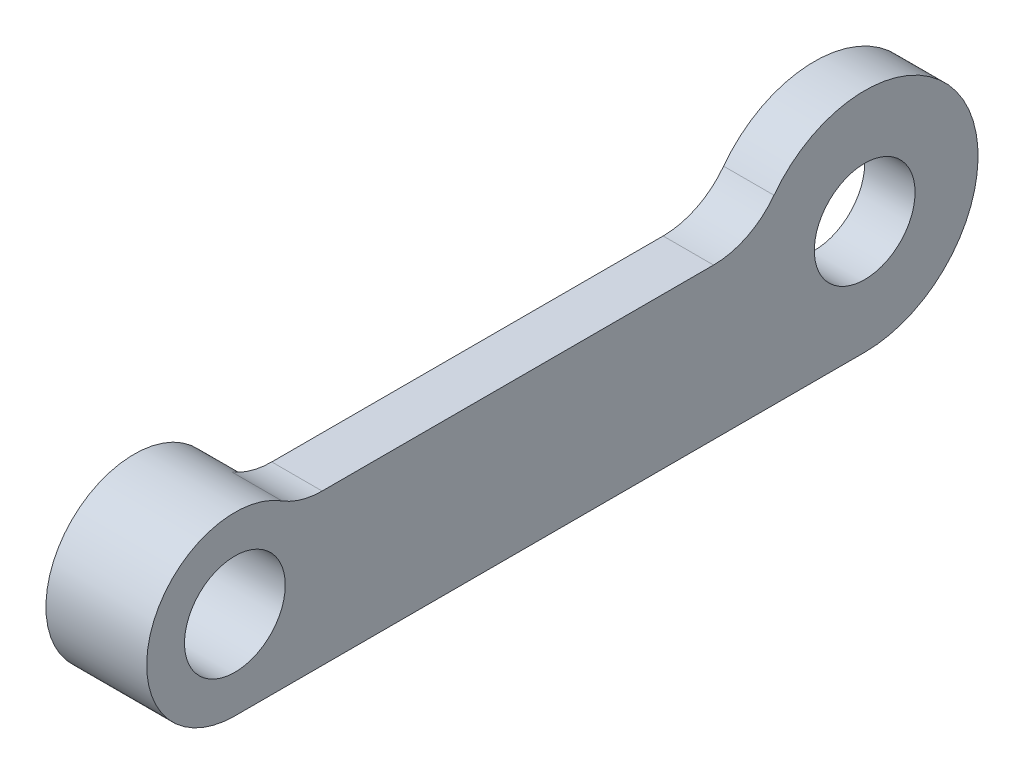
from build123d import *

# Parameters (mm, degrees)
SKETCH_1_R               = 3.5
SKETCH_1_R_2             = 4.5
SKETCH_1_W               = 25
SKETCH_1_H               = 6
EXTRUDE_1_DEPTH          = 2
EXTRUDE_START            = -2
SKETCH_1_5_R             = 3.5
EXTRUDE_3_DEPTH          = 2
CUT_EXTRUDE_2_DEPTH      = 31.170349683
CUT_EXTRUDE_2_DEPTH_BACK = 31.170349683
SKETCH_1_4_R             = 2
FILLET_1_R               = 3


with BuildPart() as part:
    # 草图1 → 凸台-拉伸1 (new body)
    with BuildSketch(Plane(origin=(0, 0, 0), x_dir=(0, 0, -1), z_dir=(1, 0, 0))):
        with Locations((0, -2.5)):
            Circle(SKETCH_1_R)
        with Locations((25, -1.5)):
            Circle(SKETCH_1_R_2)
        with Locations((12.5, -3)):
            Rectangle(SKETCH_1_W, SKETCH_1_H)
    extrude(amount=EXTRUDE_1_DEPTH)

    # 草图1<5> → 凸台-拉伸3 (add)
    with BuildSketch(Plane(origin=(0, 0, 0), x_dir=(0, 0, -1), z_dir=(1, 0, 0)).offset(EXTRUDE_START)):
        with Locations((0, -2.5)):
            Circle(SKETCH_1_5_R)
    extrude(amount=EXTRUDE_3_DEPTH)

    # 草图1<4> → 切除-拉伸2 (cut, two sides: drawn at the far end of the back side and taken through both)
    with BuildSketch(Plane(origin=(0, 0, 0), x_dir=(0, 0, -1), z_dir=(1, 0, 0)).offset(-CUT_EXTRUDE_2_DEPTH_BACK)):
        with Locations((0, -2.5)):
            Circle(SKETCH_1_4_R)
        with Locations((25, -1.5)):
            Circle(SKETCH_1_4_R)
    extrude(amount=CUT_EXTRUDE_2_DEPTH + CUT_EXTRUDE_2_DEPTH_BACK, mode=Mode.SUBTRACT)

    # 圆角1
    fillet_1_edges = [part.edges().sort_by_distance(p)[0] for p in [
        (1, 0, -20.757359313),
        (1, 0, -2.449489743),
    ]]
    fillet(fillet_1_edges, radius=FILLET_1_R)


solid = part.part
